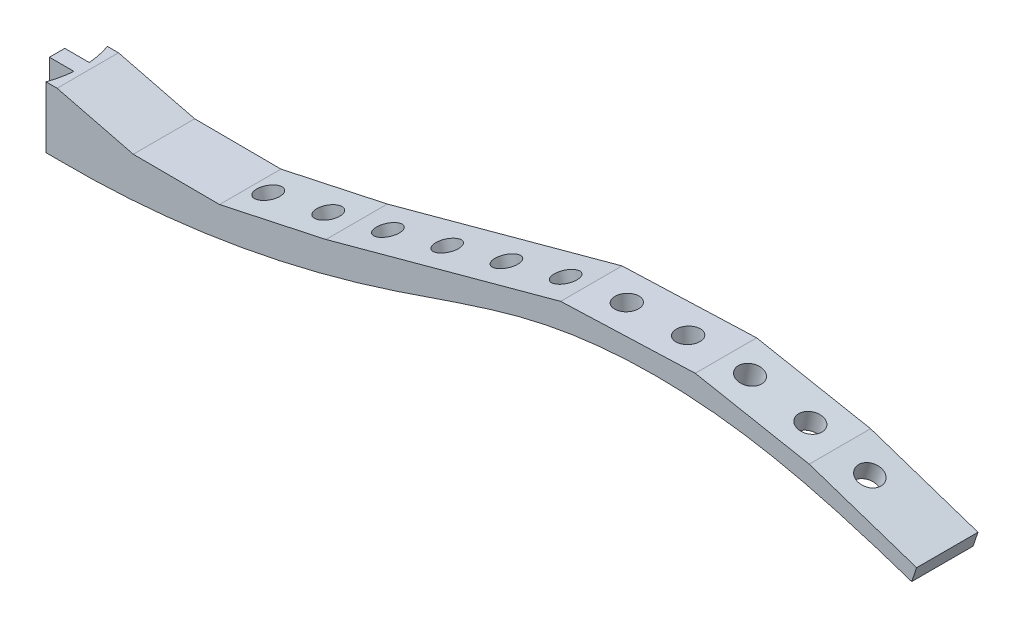
from build123d import *

# Parameters (mm, degrees)
BOSS_EXTRUDE1_DEPTH = 6.35
BOSS_EXTRUDE2_DEPTH = 12.7
SKETCH4_R           = 2.4384
CUT_EXTRUDE1_DEPTH  = 181.133623626
SKETCH5_R           = 2.4384
CUT_EXTRUDE2_DEPTH  = 180.873081441
SKETCH6_R           = 2.4384
CUT_EXTRUDE3_DEPTH  = 181.194064669
SKETCH7_R           = 2.4384
CUT_EXTRUDE4_DEPTH  = 176.76381098
SKETCH8_R           = 2.4384
CUT_EXTRUDE5_DEPTH  = 170.382823156


with BuildPart() as part:
    # Sketch1 → Boss-Extrude1 (new, symmetric)
    with BuildSketch(Plane.XY):
        with BuildLine():
            Line((0, 0), (0, 12.7))
            Line((0, 12.7), (15.766333133, 8.755705543))
            Line((15.766333133, 8.755705543), (33.607908361, 8.670214307))
            Line((33.607908361, 8.670214307), (55.614085321, 13.411920085))
            Line((55.614085321, 13.411920085), (104.172359921, 26.605278245))
            Line((104.172359921, 26.605278245), (132.003431072, 27.638141638))
            Line((132.003431072, 27.638141638), (155.578125593, 23.147235579))
            Line((155.578125593, 23.147235579), (177.8, 15.707098221))
            Line((177.8, 15.707098221), (176.781184369, 12.7))
            add(Edge.make_bspline(
                [(0, 0), (23.08530413, -0.295297042), (56.945329021, 5.580393203), (102.575867003, 23.571064474), (140.786137087, 23.994341582), (166.198692543, 16.285386075), (176.781184369, 12.7)],
                knots=[0, 0, 0, 0, 0.38195347, 0.565829445, 0.810764249, 1, 1, 1, 1], degree=3))
        make_face()
    extrude(amount=BOSS_EXTRUDE1_DEPTH, both=True)

    # Sketch2 → Boss-Extrude2 (add)
    with BuildSketch(Plane(origin=(0, 0, 0), x_dir=(1, 0, 0), z_dir=(0, 1, 0))):
        with BuildLine():
            Line((0, 6.35), (-2.293226688, 6.35))
            ThreePointArc((-2.293226688, 6.35), (-1.628761742, 4.001590281), (-1.27, 1.5875))
            Line((-1.27, 1.5875), (-6.35, 1.5875))
            Line((-6.35, 1.5875), (-6.35, -1.5875))
            Line((-6.35, -1.5875), (-1.27, -1.5875))
            ThreePointArc((-1.27, -1.5875), (-1.628761742, -4.001590281), (-2.293226688, -6.35))
            Line((-2.293226688, -6.35), (0, -6.35))
            Line((0, -6.35), (0, 6.35))
        make_face()
    extrude(amount=BOSS_EXTRUDE2_DEPTH)

    # Sketch4 → Cut-Extrude1 (cut, through all)
    with BuildSketch(Plane(origin=(-0.294178606, 1.365277973, 0), x_dir=(0.9775642784393743, 0.21063732223731266, 0), z_dir=(-0.21063732223731266, 0.9775642784393743, 0))):
        with Locations(Location((38.490161411, 0, 0), (0, 0, 180))):
            Circle(SKETCH4_R)
        with Locations(Location((51.190161411, 0, 0), (0, 0, 180))):
            Circle(SKETCH4_R)
    extrude(amount=-CUT_EXTRUDE1_DEPTH, mode=Mode.SUBTRACT)

    # Sketch5 → Cut-Extrude2 (cut, through all)
    with BuildSketch(Plane(origin=(0.429762706, -1.581745547, 0), x_dir=(0.9650146493456933, 0.2621959697405908, 0), z_dir=(-0.2621959697405908, 0.9650146493456933, 0))):
        with Locations(Location((63.892174826, 0, 0), (0, 0, 180))):
            Circle(SKETCH5_R)
        with Locations(Location((76.592174826, 0, 0), (0, 0, 180))):
            Circle(SKETCH5_R)
        with Locations(Location((89.292174826, 0, 0), (0, 0, 180))):
            Circle(SKETCH5_R)
        with Locations(Location((101.992174826, 0, 0), (0, 0, 180))):
            Circle(SKETCH5_R)
    extrude(amount=-CUT_EXTRUDE2_DEPTH, mode=Mode.SUBTRACT)

    # Sketch6 → Cut-Extrude3 (cut, through all)
    with BuildSketch(Plane(origin=(-0.842735495, 22.707970549, 0), x_dir=(0.9993120646887612, 0.037086350150496564, 0), z_dir=(-0.03708635015049657, 0.9993120646887613, 0))):
        with Locations(Location((112.418800254, 0, 0), (0, 0, 180))):
            Circle(SKETCH6_R)
        with Locations(Location((125.118800254, 0, 0), (0, 0, 180))):
            Circle(SKETCH6_R)
    extrude(amount=-CUT_EXTRUDE3_DEPTH, mode=Mode.SUBTRACT)

    # Sketch7 → Cut-Extrude4 (cut, through all)
    with BuildSketch(Plane(origin=(9.703143349, 50.935966455, 0), x_dir=(0.9823348281800496, -0.1871317325962448, 0), z_dir=(0.1871317325962448, 0.9823348281800496, 0))):
        with Locations(Location((129.578443117, 0, 0), (0, 0, 180))):
            Circle(SKETCH7_R)
        with Locations(Location((142.278443117, 0, 0), (0, 0, 180))):
            Circle(SKETCH7_R)
    extrude(amount=-CUT_EXTRUDE4_DEPTH, mode=Mode.SUBTRACT)

    # Sketch8 → Cut-Extrude5 (cut, through all)
    with BuildSketch(Plane(origin=(22.650923767, 67.652780978, 0), x_dir=(0.9482619749403749, -0.3174889397792934, 0), z_dir=(0.3174889397792934, 0.9482619749403749, 0))):
        with Locations(Location((146.716500367, 0, 0), (0, 0, 180))):
            Circle(SKETCH8_R)
    extrude(amount=-CUT_EXTRUDE5_DEPTH, mode=Mode.SUBTRACT)


solid = part.part
